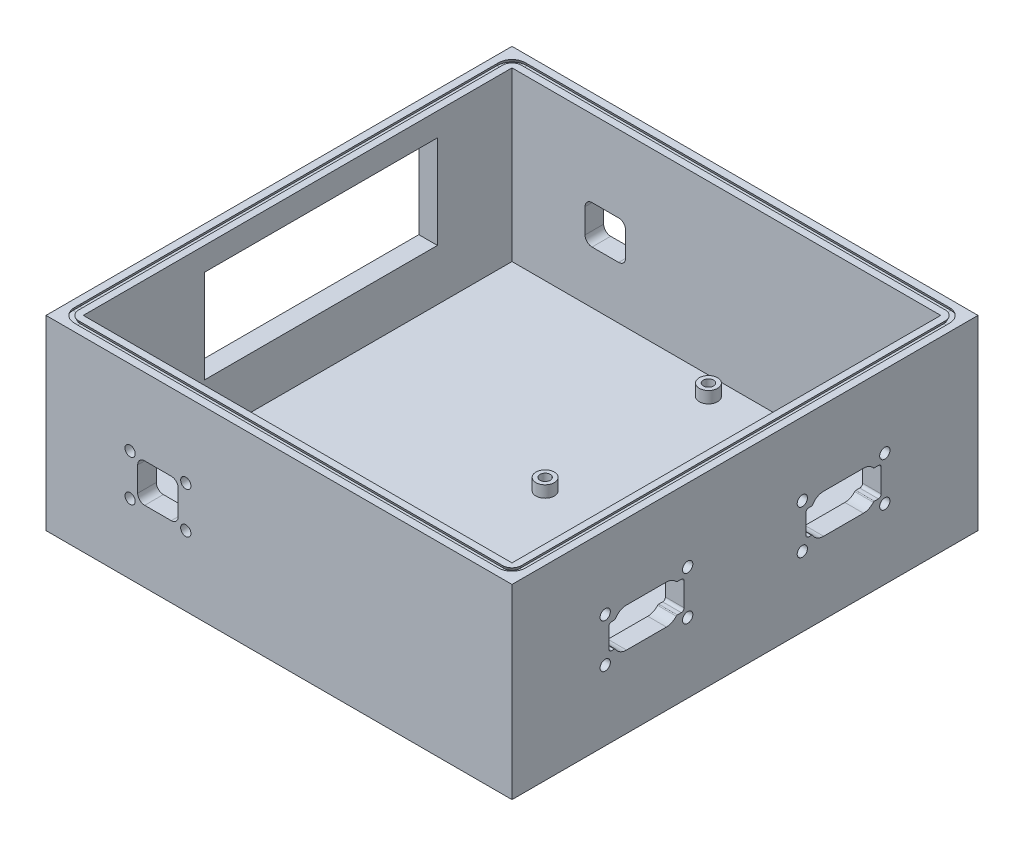
from build123d import *

# Parameters (mm, degrees)
SKETCH1_W           = 254
SKETCH1_H           = 254
BOSS_EXTRUDE1_DEPTH = 101.6
SKETCH2_W           = 233.68
SKETCH2_H           = 233.68
CUT_EXTRUDE1_DEPTH  = 91.44
CUT_EXTRUDE10_REACH = 375.302
F_12_PIN_MOUNT_R    = 2.7999944
CUT_EXTRUDE3_DEPTH  = 5.499989
CUT_EXTRUDE5_REACH  = 375.302
CUT_EXTRUDE6_START  = -254
CUT_EXTRUDE6_DEPTH  = 10.16
SKETCH6_R           = 2.7999944
CUT_EXTRUDE7_DEPTH  = 5.499989
CUT_EXTRUDE8_START  = -248.500011
SKETCH6_2_R         = 2.7999944
CUT_EXTRUDE8_DEPTH  = 5.499989
SKETCH7_R           = 5
BOSS_EXTRUDE2_DEPTH = 6.35
CUT_EXTRUDE9_START  = 6.35
SKETCH8_R           = 2.7999944
CUT_EXTRUDE9_DEPTH  = 5.499989
CUT_EXTRUDE11_REACH = 375.302
SKETCH14_W          = 127
SKETCH14_H          = 50.8


with BuildPart() as part:
    # Sketch1 → Boss-Extrude1 (new body)
    with BuildSketch(Plane(origin=(0, 0, 0), x_dir=(1, 0, 0), z_dir=(0, 1, 0))):
        with Locations((127, 127)):
            Rectangle(SKETCH1_W, SKETCH1_H)
    extrude(amount=BOSS_EXTRUDE1_DEPTH)

    # Sketch2 → Cut-Extrude1 (cut)
    with BuildSketch(Plane(origin=(0, 101.6, 0), x_dir=(1, 0, 0), z_dir=(0, 1, 0))):
        with Locations((127, 127)):
            Rectangle(SKETCH2_W, SKETCH2_H)
    extrude(amount=-CUT_EXTRUDE1_DEPTH, mode=Mode.SUBTRACT)

    # Cut-Sweep2: sweep along a path in Sketch3
    with BuildLine(Plane(origin=(0, 101.6, 0), x_dir=(1, 0, 0), z_dir=(0, 1, 0))) as cut_sweep2_path:
        Line((6.35, 11.43), (6.35, 242.57))
        ThreePointArc((6.35, 242.57), (7.837897552, 246.162102448), (11.43, 247.65))
        Line((11.43, 247.65), (242.57, 247.65))
        ThreePointArc((242.57, 247.65), (246.162102448, 246.162102448), (247.65, 242.57))
        Line((247.65, 242.57), (247.65, 11.43))
        ThreePointArc((247.65, 11.43), (246.162102448, 7.837897552), (242.57, 6.35))
        Line((242.57, 6.35), (11.43, 6.35))
        ThreePointArc((11.43, 6.35), (7.837897552, 7.837897552), (6.35, 11.43))
    # Sketch4 → Cut-Sweep2 (sweep, cut)
    with BuildSketch(Plane.XY.offset(-15.24)):
        Polygon((4.064, 101.6), (3.272383398, 99.822), (7.141616602, 99.822), (6.35, 101.6), align=None)
    sweep(path=cut_sweep2_path.line, mode=Mode.SUBTRACT)

    # Sketch13 → Cut-Extrude10 (cut, up to next)
    with BuildSketch(Plane(origin=(254, 0, 0), x_dir=(0, 0, -1), z_dir=(1, 0, 0)), mode=Mode.PRIVATE) as cut_extrude10_sk1:
        with BuildLine():
            Line((55.735714122, 56.896), (54.2925, 56.896))
            ThreePointArc((54.2925, 56.896), (53.214869265, 56.449630735), (52.7685, 55.372))
            Line((52.7685, 55.372), (52.7685, 44.704))
            ThreePointArc((52.7685, 44.704), (53.214869265, 43.626369265), (54.2925, 43.18))
            Line((54.2925, 43.18), (55.735714122, 43.18))
            ThreePointArc((55.735714122, 43.18), (56.109218307, 43.082182673), (56.386829629, 42.813844156))
            ThreePointArc((56.386829629, 42.813844156), (58.959361214, 40.327240562), (62.4205, 39.4208))
            Line((62.4205, 39.4208), (84.1375, 39.4208))
            ThreePointArc((84.1375, 39.4208), (87.094150798, 40.069608753), (89.507465925, 41.896805195))
            ThreePointArc((89.507465925, 41.896805195), (89.767895615, 42.093984667), (90.086958651, 42.164))
            Line((90.086958651, 42.164), (92.2655, 42.164))
            ThreePointArc((92.2655, 42.164), (93.343130735, 42.610369265), (93.7895, 43.688))
            Line((93.7895, 43.688), (93.7895, 56.388))
            ThreePointArc((93.7895, 56.388), (93.343130735, 57.465630735), (92.2655, 57.912))
            Line((92.2655, 57.912), (90.086958651, 57.912))
            ThreePointArc((90.086958651, 57.912), (89.767895615, 57.982015333), (89.507465925, 58.179194805))
            ThreePointArc((89.507465925, 58.179194805), (87.094150798, 60.006391247), (84.1375, 60.6552))
            Line((84.1375, 60.6552), (62.4205, 60.6552))
            ThreePointArc((62.4205, 60.6552), (58.959361214, 59.748759438), (56.386829629, 57.262155844))
            ThreePointArc((56.386829629, 57.262155844), (56.109218307, 56.993817327), (55.735714122, 56.896))
        make_face()
    cut_extrude10_tool1 = extrude(cut_extrude10_sk1.sketch, amount=-CUT_EXTRUDE10_REACH, mode=Mode.PRIVATE) & part.part
    # Sketch13 → Cut-Extrude10 (cut, up to next)
    with BuildSketch(Plane(origin=(254, 0, 0), x_dir=(0, 0, -1), z_dir=(1, 0, 0)), mode=Mode.PRIVATE) as cut_extrude10_sk2:
        with BuildLine():
            Line((163.177714122, 56.896), (161.7345, 56.896))
            ThreePointArc((161.7345, 56.896), (160.656869265, 56.449630735), (160.2105, 55.372))
            Line((160.2105, 55.372), (160.2105, 44.704))
            ThreePointArc((160.2105, 44.704), (160.656869265, 43.626369265), (161.7345, 43.18))
            Line((161.7345, 43.18), (163.177714122, 43.18))
            ThreePointArc((163.177714122, 43.18), (163.551218307, 43.082182673), (163.828829629, 42.813844156))
            ThreePointArc((163.828829629, 42.813844156), (166.401361214, 40.327240562), (169.8625, 39.4208))
            Line((169.8625, 39.4208), (191.5795, 39.4208))
            ThreePointArc((191.5795, 39.4208), (194.536150798, 40.069608753), (196.949465925, 41.896805195))
            ThreePointArc((196.949465925, 41.896805195), (197.209895615, 42.093984667), (197.528958651, 42.164))
            Line((197.528958651, 42.164), (199.7075, 42.164))
            ThreePointArc((199.7075, 42.164), (200.785130735, 42.610369265), (201.2315, 43.688))
            Line((201.2315, 43.688), (201.2315, 56.388))
            ThreePointArc((201.2315, 56.388), (200.785130735, 57.465630735), (199.7075, 57.912))
            Line((199.7075, 57.912), (197.528958651, 57.912))
            ThreePointArc((197.528958651, 57.912), (197.209895615, 57.982015333), (196.949465925, 58.179194805))
            ThreePointArc((196.949465925, 58.179194805), (194.536150798, 60.006391247), (191.5795, 60.6552))
            Line((191.5795, 60.6552), (169.8625, 60.6552))
            ThreePointArc((169.8625, 60.6552), (166.401361214, 59.748759438), (163.828829629, 57.262155844))
            ThreePointArc((163.828829629, 57.262155844), (163.551218307, 56.993817327), (163.177714122, 56.896))
        make_face()
    cut_extrude10_tool2 = extrude(cut_extrude10_sk2.sketch, amount=-CUT_EXTRUDE10_REACH, mode=Mode.PRIVATE) & part.part
    add(cut_extrude10_tool1.solids().sort_by_distance((254, 50.038, -73.454803))[0], mode=Mode.SUBTRACT)
    add(cut_extrude10_tool2.solids().sort_by_distance((254, 50.038, -180.896803))[0], mode=Mode.SUBTRACT)

    # 12 pin mount → Cut-Extrude3 (cut)
    with BuildSketch(Plane(origin=(254, 0, 0), x_dir=(0, 0, -1), z_dir=(1, 0, 0))):
        with Locations((95.758, 61.976)):
            Circle(F_12_PIN_MOUNT_R)
        with Locations((95.758, 38.1)):
            Circle(F_12_PIN_MOUNT_R)
        with Locations((50.8, 38.1)):
            Circle(F_12_PIN_MOUNT_R)
        with Locations((50.8, 61.976)):
            Circle(F_12_PIN_MOUNT_R)
        with Locations((158.242, 61.976)):
            Circle(F_12_PIN_MOUNT_R)
        with Locations((203.2, 61.976)):
            Circle(F_12_PIN_MOUNT_R)
        with Locations((203.2, 38.1)):
            Circle(F_12_PIN_MOUNT_R)
        with Locations((158.242, 38.1)):
            Circle(F_12_PIN_MOUNT_R)
    extrude(amount=-CUT_EXTRUDE3_DEPTH, mode=Mode.SUBTRACT)

    # 4 pin connector → Cut-Extrude5 (cut, up to next)
    with BuildSketch(Plane.XY, mode=Mode.PRIVATE) as cut_extrude5_sk1:
        with BuildLine():
            Line((53.7845, 59.817), (68.2625, 59.817))
            ThreePointArc((68.2625, 59.817), (70.956576836, 58.701076836), (72.0725, 56.007))
            Line((72.0725, 56.007), (72.0725, 42.6466))
            ThreePointArc((72.0725, 42.6466), (70.956576836, 39.952523164), (68.2625, 38.8366))
            Line((68.2625, 38.8366), (53.7845, 38.8366))
            ThreePointArc((53.7845, 38.8366), (51.090423164, 39.952523164), (49.9745, 42.6466))
            Line((49.9745, 42.6466), (49.9745, 56.007))
            ThreePointArc((49.9745, 56.007), (51.090423164, 58.701076836), (53.7845, 59.817))
        make_face()
    cut_extrude5_tool1 = extrude(cut_extrude5_sk1.sketch, amount=-CUT_EXTRUDE5_REACH, mode=Mode.PRIVATE) & part.part
    add(cut_extrude5_tool1.solids().sort_by_distance((61.0235, 49.3268, 0))[0], mode=Mode.SUBTRACT)

    # Sketch5<2> → Cut-Extrude6 (cut)
    with BuildSketch(Plane.XY.offset(CUT_EXTRUDE6_START)):
        with BuildLine():
            Line((53.7845, 59.817), (68.2625, 59.817))
            ThreePointArc((68.2625, 59.817), (70.956576836, 58.701076836), (72.0725, 56.007))
            Line((72.0725, 56.007), (72.0725, 42.6466))
            ThreePointArc((72.0725, 42.6466), (70.956576836, 39.952523164), (68.2625, 38.8366))
            Line((68.2625, 38.8366), (53.7845, 38.8366))
            ThreePointArc((53.7845, 38.8366), (51.090423164, 39.952523164), (49.9745, 42.6466))
            Line((49.9745, 42.6466), (49.9745, 56.007))
            ThreePointArc((49.9745, 56.007), (51.090423164, 58.701076836), (53.7845, 59.817))
        make_face()
    extrude(amount=CUT_EXTRUDE6_DEPTH, mode=Mode.SUBTRACT)

    # Sketch6 → Cut-Extrude7 (cut)
    with BuildSketch(Plane.XY):
        with Locations((76.2, 60.5536)):
            Circle(SKETCH6_R)
        with Locations((76.2, 38.1)):
            Circle(SKETCH6_R)
        with Locations((45.847, 38.1)):
            Circle(SKETCH6_R)
        with Locations((45.847, 60.5536)):
            Circle(SKETCH6_R)
    extrude(amount=-CUT_EXTRUDE7_DEPTH, mode=Mode.SUBTRACT)

    # Sketch6<2> → Cut-Extrude8 (cut)
    with BuildSketch(Plane.XY.offset(CUT_EXTRUDE8_START)):
        with Locations((76.2, 60.5536)):
            Circle(SKETCH6_2_R)
        with Locations((76.2, 38.1)):
            Circle(SKETCH6_2_R)
        with Locations((45.847, 38.1)):
            Circle(SKETCH6_2_R)
        with Locations((45.847, 60.5536)):
            Circle(SKETCH6_2_R)
    extrude(amount=-CUT_EXTRUDE8_DEPTH, mode=Mode.SUBTRACT)

    # Sketch7 → Boss-Extrude2 (add)
    with BuildSketch(Plane(origin=(0, 10.16, 0), x_dir=(1, 0, 0), z_dir=(0, 1, 0))):
        with Locations(Location((127.38, 144.673865575, 0), (0, 0, 90))):
            Circle(SKETCH7_R)
        with Locations(Location((193.04, 144.673865575, 0), (0, 0, 90))):
            Circle(SKETCH7_R)
        with Locations(Location((193.04, 233.703865575, 0), (0, 0, 90))):
            Circle(SKETCH7_R)
        with Locations(Location((127.38, 233.703865575, 0), (0, 0, 90))):
            Circle(SKETCH7_R)
    extrude(amount=BOSS_EXTRUDE2_DEPTH)

    # Sketch8 → Cut-Extrude9 (cut)
    with BuildSketch(Plane(origin=(0, 10.16, 0), x_dir=(1, 0, 0), z_dir=(0, 1, 0)).offset(CUT_EXTRUDE9_START)):
        with Locations(Location((127.38, 233.703865575, 0), (0, 0, 270))):
            Circle(SKETCH8_R)
        with Locations(Location((193.04, 233.703865575, 0), (0, 0, 270))):
            Circle(SKETCH8_R)
        with Locations(Location((193.04, 144.673865575, 0), (0, 0, 270))):
            Circle(SKETCH8_R)
        with Locations(Location((127.38, 144.673865575, 0), (0, 0, 270))):
            Circle(SKETCH8_R)
    extrude(amount=-CUT_EXTRUDE9_DEPTH, mode=Mode.SUBTRACT)

    # Sketch14 → Cut-Extrude11 (cut, up to next)
    with BuildSketch(Plane.ZY, mode=Mode.PRIVATE) as cut_extrude11_sk1:
        with Locations((-139.7, 63.5)):
            Rectangle(SKETCH14_W, SKETCH14_H)
    cut_extrude11_tool1 = extrude(cut_extrude11_sk1.sketch, amount=-CUT_EXTRUDE11_REACH, mode=Mode.PRIVATE) & part.part
    add(cut_extrude11_tool1.solids().sort_by_distance((0, 63.5, -139.7))[0], mode=Mode.SUBTRACT)


solid = part.part
